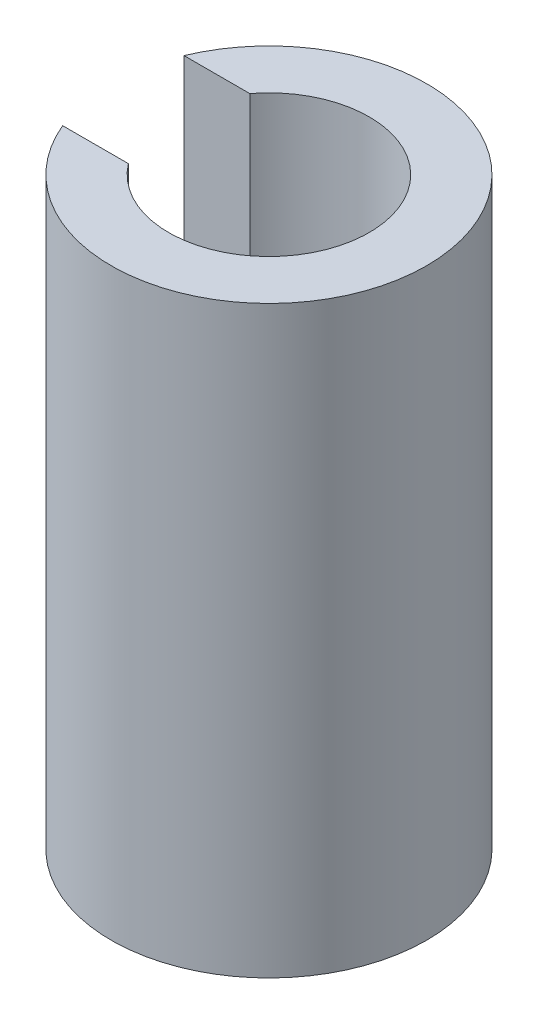
from build123d import *

# Parameters (mm, degrees)
SKETCH_1_R          = 4.05
SKETCH_1_R_2        = 2.575
EXTRUDE_1_DEPTH     = 15
SKETCH_2_W          = 2
SKETCH_2_H          = 3.116488408
CUT_EXTRUDE_1_DEPTH = 15


with BuildPart() as part:
    # 草圖1 → 填料-伸長1 (new body)
    with BuildSketch(Plane(origin=(0, 0, 0), x_dir=(1, 0, 0), z_dir=(0, 1, 0))):
        Circle(SKETCH_1_R)
        Circle(SKETCH_1_R_2, mode=Mode.SUBTRACT)
    extrude(amount=EXTRUDE_1_DEPTH)

    # 草圖2 → 除料-伸長1 (cut)
    with BuildSketch(Plane(origin=(0, 15, 0), x_dir=(1, 0, 0), z_dir=(0, 1, 0))):
        with Locations((-3.05, 0)):
            Rectangle(SKETCH_2_W, SKETCH_2_H)
    extrude(amount=-CUT_EXTRUDE_1_DEPTH, mode=Mode.SUBTRACT)


solid = part.part
